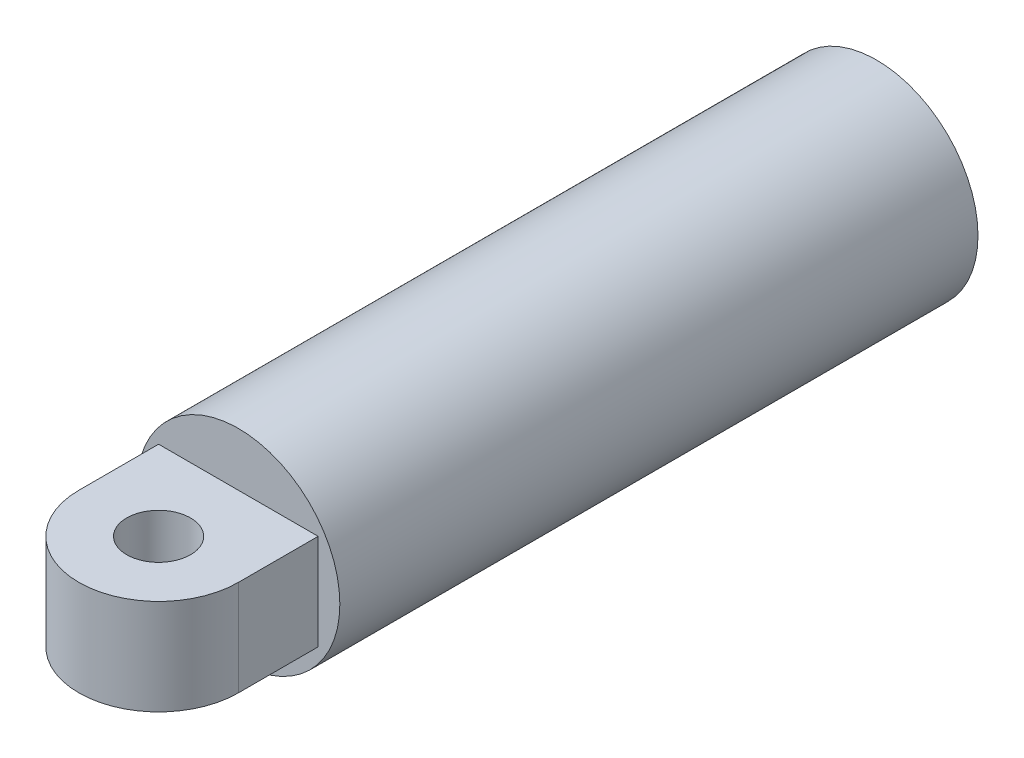
from build123d import *

# Parameters (mm, degrees)
SKETCH_1_R          = 15.9
EXTRUDE_1_DEPTH     = 100
SKETCH_2_W          = 25
SKETCH_2_H          = 15
EXTRUDE_2_DEPTH     = 25
SKETCH_3_R          = 5
CUT_EXTRUDE_1_DEPTH = 129.161499679
SKETCH_4_R          = 14
CUT_EXTRUDE_2_DEPTH = 52


with BuildPart() as part:
    # Эскиз1 → Бобышка-Вытянуть1 (new body)
    with BuildSketch(Plane.XY):
        Circle(SKETCH_1_R)
    extrude(amount=EXTRUDE_1_DEPTH)

    # Эскиз2 → Бобышка-Вытянуть2 (add)
    with BuildSketch(Plane.XY.offset(100)):
        Rectangle(SKETCH_2_W, SKETCH_2_H)
    extrude(amount=EXTRUDE_2_DEPTH)

    # Эскиз3 → Вырез-Вытянуть1 (cut, through all)
    with BuildSketch(Plane(origin=(0, -7.5, 0), x_dir=(1, 0, 0), z_dir=(0, 1, 0))):
        with Locations((0, -112.5)):
            Circle(SKETCH_3_R)
        with BuildLine():
            Line((-12.5, -112.5), (-20.699880193, -112.5))
            Line((-20.699880193, -112.5), (-20.699880193, -150.973701631))
            Line((-20.699880193, -150.973701631), (17.84150118, -150.973701631))
            Line((17.84150118, -150.973701631), (17.84150118, -132.5))
            Line((17.84150118, -132.5), (12.5, -112.5))
            ThreePointArc((12.5, -112.5), (0, -125), (-12.5, -112.5))
        make_face()
    extrude(amount=CUT_EXTRUDE_1_DEPTH, mode=Mode.SUBTRACT)

    # Эскиз4 → Вырез-Вытянуть2 (cut)
    with BuildSketch(Plane(origin=(0, 0, 0), x_dir=(-1, 0, 0), z_dir=(0, 0, -1))):
        Circle(SKETCH_4_R)
    extrude(amount=-CUT_EXTRUDE_2_DEPTH, mode=Mode.SUBTRACT)


solid = part.part
